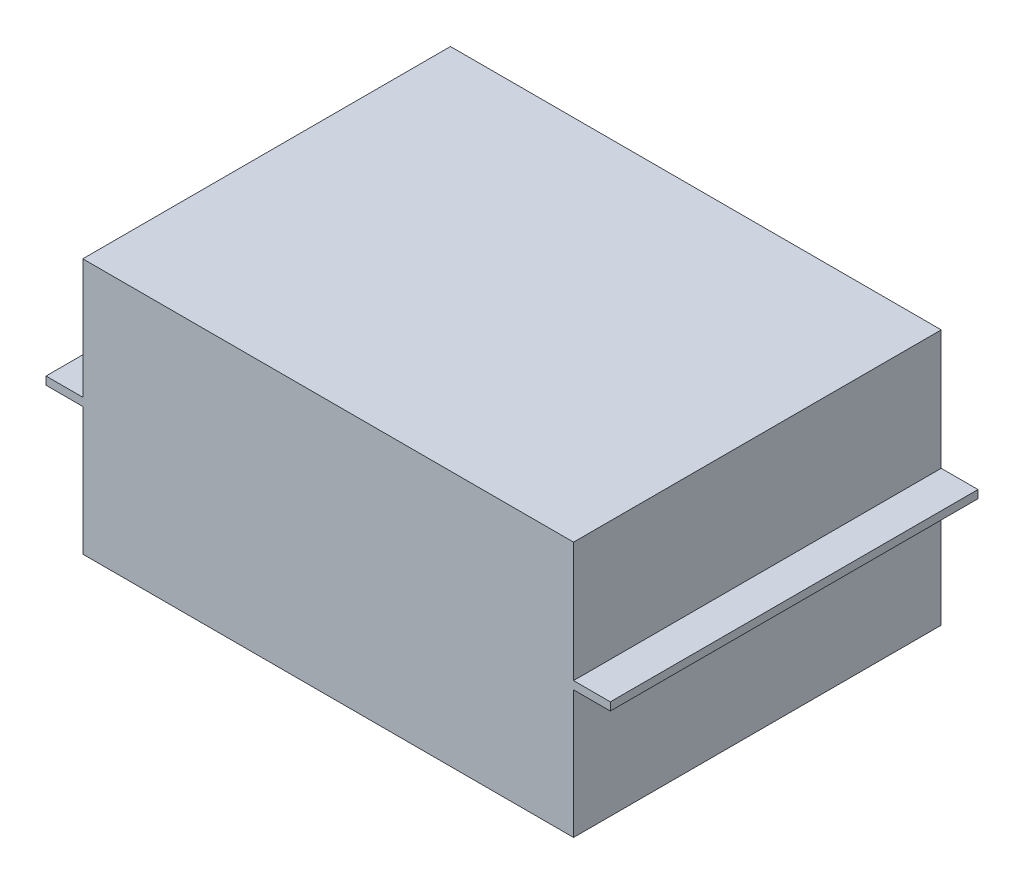
from build123d import *

# Parameters (mm, degrees)
SKETCH1_W           = 307
SKETCH1_H           = 230
BOSS_EXTRUDE1_DEPTH = 160
BOSS_EXTRUDE2_START = 80
SKETCH1_3_W         = 23
SKETCH1_3_H         = 230
BOSS_EXTRUDE2_DEPTH = 5


with BuildPart() as part:
    # Sketch1 → Boss-Extrude1 (new body)
    with BuildSketch(Plane(origin=(0, 0, 0), x_dir=(1, 0, 0), z_dir=(0, 1, 0))):
        Rectangle(SKETCH1_W, SKETCH1_H)
    extrude(amount=BOSS_EXTRUDE1_DEPTH)

    # Sketch1<3> → Boss-Extrude2 (add)
    with BuildSketch(Plane(origin=(0, 0, 0), x_dir=(1, 0, 0), z_dir=(0, 1, 0)).offset(BOSS_EXTRUDE2_START)):
        with Locations((-165, 0)):
            Rectangle(SKETCH1_3_W, SKETCH1_3_H)
        with Locations((165, 0)):
            Rectangle(SKETCH1_3_W, SKETCH1_3_H)
    extrude(amount=BOSS_EXTRUDE2_DEPTH)


solid = part.part
